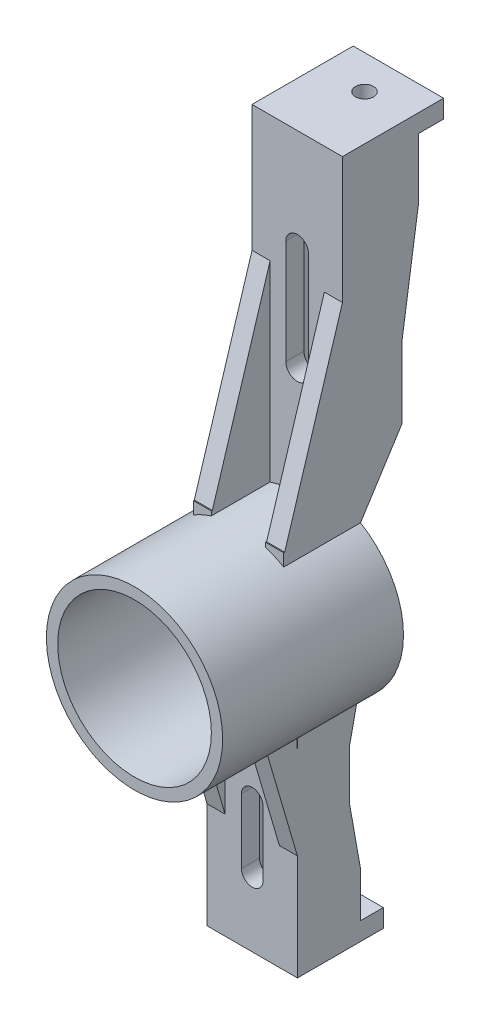
from build123d import *

# Parameters (mm, degrees)
SKETCH1_R            = 39
SKETCH1_R_2          = 34
BOSS_EXTRUDE1_DEPTH  = 80
BOSS_EXTRUDE2_DEPTH  = 20
BOSS_EXTRUDE3_DEPTH  = 20
BOSS_EXTRUDE4_DEPTH  = 8
BOSS_EXTRUDE5_DEPTH  = 8
CUT_EXTRUDE1_DEPTH   = 73
SKETCH13_R           = 4
CUT_EXTRUDE2_DEPTH   = 24
SKETCH14_R           = 4
CUT_EXTRUDE3_DEPTH   = 24
BOSS_EXTRUDE6_DEPTH  = 8
BOSS_EXTRUDE7_DEPTH  = 8
BOSS_EXTRUDE8_DEPTH  = 8
BOSS_EXTRUDE14_DEPTH = 8
BOSS_EXTRUDE15_DEPTH = 8
BOSS_EXTRUDE16_DEPTH = 8
BOSS_EXTRUDE17_DEPTH = 8
BOSS_EXTRUDE18_DEPTH = 26
BOSS_EXTRUDE19_REACH = 195.204


with BuildPart() as part:
    # Sketch1 → Boss-Extrude1 (new body)
    with BuildSketch(Plane.XY):
        Circle(SKETCH1_R)
        Circle(SKETCH1_R_2, mode=Mode.SUBTRACT)
    extrude(amount=BOSS_EXTRUDE1_DEPTH)



with BuildPart() as body_2:
    # Sketch3 → Boss-Extrude2 (new, symmetric)
    with BuildSketch(Plane(origin=(0, 0, 0), x_dir=(0, 0, -1), z_dir=(1, 0, 0))):
        Polygon((-8, 39), (-8, 177.8), (36.76, 177.8), (36.76, 169.8), (0, 169.8), (0, 39), align=None)
    extrude(amount=BOSS_EXTRUDE2_DEPTH, both=True)


with BuildPart() as body_3:
    # Sketch4 → Boss-Extrude3 (new, symmetric)
    with BuildSketch(Plane(origin=(0, 0, 0), x_dir=(0, 0, -1), z_dir=(1, 0, 0))):
        Polygon((-27.91, -39), (-27.91, -127), (10.09, -127), (10.09, -119), (-19.91, -119), (-19.91, -39), align=None)
    extrude(amount=BOSS_EXTRUDE3_DEPTH, both=True)


with BuildPart() as part_1:
    add(part.part)

    add(body_3.part)  # Boss-Extrude4 merges body 3
    # Sketch6 → Boss-Extrude4 (add)
    with BuildSketch(Plane(origin=(0, 0, 19.91), x_dir=(-1, 0, 0), z_dir=(0, 0, -1))):
        with BuildLine():
            ThreePointArc((20, -33.481338086), (10.373712322, -37.595027499), (0, -39))
            Line((0, -39), (20, -39))
            Line((20, -39), (20, -33.481338086))
        make_face()
        with BuildLine():
            Line((-20, -33.481338086), (-20, -39))
            Line((-20, -39), (0, -39))
            ThreePointArc((0, -39), (-10.373712322, -37.595027499), (-20, -33.481338086))
        make_face()
    extrude(amount=-BOSS_EXTRUDE4_DEPTH)


    add(body_2.part)  # Boss-Extrude5 merges body 2
    # Sketch7 → Boss-Extrude5 (add)
    with BuildSketch(Plane(origin=(0, 0, 0), x_dir=(-1, 0, 0), z_dir=(0, 0, -1))):
        with BuildLine():
            Line((0, 39), (-20, 39))
            Line((-20, 39), (-20, 33.481338086))
            ThreePointArc((-20, 33.481338086), (-10.373712322, 37.595027499), (0, 39))
        make_face()
        with BuildLine():
            Line((20, 39), (0, 39))
            ThreePointArc((0, 39), (10.373712322, 37.595027499), (20, 33.481338086))
            Line((20, 33.481338086), (20, 39))
        make_face()
    extrude(amount=-BOSS_EXTRUDE5_DEPTH)

    # Sketch12 → Cut-Extrude1 (cut)
    with BuildSketch(Plane(origin=(0, 0, 0), x_dir=(-1, 0, 0), z_dir=(0, 0, -1))):
        with BuildLine():
            Line((5.059933618, 132.933679622), (5.059933618, 86.710392146))
            ThreePointArc((5.059933618, 86.710392146), (0, 81.650458528), (-5.059933618, 86.710392146))
            Line((-5.059933618, 86.710392146), (-5.059933618, 132.933679622))
            ThreePointArc((-5.059933618, 132.933679622), (0, 137.993613239), (5.059933618, 132.933679622))
        make_face()
        with BuildLine():
            Line((4.756389645, -68.737317272), (4.756389645, -97.444530968))
            ThreePointArc((4.756389645, -97.444530968), (0, -102.200920613), (-4.756389645, -97.444530968))
            Line((-4.756389645, -97.444530968), (-4.756389645, -68.737317272))
            ThreePointArc((-4.756389645, -68.737317272), (0, -63.980927627), (4.756389645, -68.737317272))
        make_face()
    extrude(amount=-CUT_EXTRUDE1_DEPTH, mode=Mode.SUBTRACT)

    # Sketch13 → Cut-Extrude2 (cut)
    with BuildSketch(Plane(origin=(0, 177.8, 0), x_dir=(1, 0, 0), z_dir=(0, 1, 0))):
        with Locations(Location((0, 21.76, 0), (0, 0, 270))):
            Circle(SKETCH13_R)
    extrude(amount=-CUT_EXTRUDE2_DEPTH, mode=Mode.SUBTRACT)

    # Sketch14 → Cut-Extrude3 (cut)
    with BuildSketch(Plane.XZ.offset(127)):
        with Locations(Location((0, 4.91, 0), (0, 0, 270))):
            Circle(SKETCH14_R)
    extrude(amount=-CUT_EXTRUDE3_DEPTH, mode=Mode.SUBTRACT)

    # Sketch15 → Boss-Extrude6 (add)
    with BuildSketch(Plane(origin=(20, 0, 0), x_dir=(0, 0, -1), z_dir=(1, 0, 0))):
        Polygon((0, -119), (0, -99.086888853), (-4.91, -71.464610667), (-4.91, -49.814716953), (-1.4130197, -33.634678949), (-19.91, -33.481338086), (-19.91, -119), align=None)
    extrude(amount=-BOSS_EXTRUDE6_DEPTH)

    # Sketch16 → Boss-Extrude7 (add)
    with BuildSketch(Plane.ZY.offset(20)):
        Polygon((0, -119), (0, -99.086888853), (4.91, -71.464610667), (4.91, -49.814716953), (1.379878246, -33.481338086), (19.91, -33.481338086), (19.91, -119), align=None)
    extrude(amount=-BOSS_EXTRUDE7_DEPTH)

    # Sketch17 → Boss-Extrude8 (add)
    with BuildSketch(Plane(origin=(20, 0, 0), x_dir=(0, 0, -1), z_dir=(1, 0, 0))):
        Polygon((25.76, 169.8), (25.76, 143.643001818), (18.38, 94.201688411), (18.38, 62.304066859), (0, 33.481338086), (0, 169.8), align=None)
    extrude(amount=-BOSS_EXTRUDE8_DEPTH)

    # Sketch23 → Boss-Extrude14 (add)
    with BuildSketch(Plane(origin=(20, 0, 0), x_dir=(0, 0, -1), z_dir=(1, 0, 0))):
        Polygon((-8, 121.891336637), (-33.564768945, 39), (-8, 39), align=None)
        Polygon((-40, -39), (-27.91, -80.240669043), (-27.91, -39), align=None)
    extrude(amount=-BOSS_EXTRUDE14_DEPTH)

    # Sketch24 → Boss-Extrude15 (add)
    with BuildSketch(Plane.ZY.offset(20)):
        Polygon((0, 169.8), (-25.76, 169.8), (-25.76, 143.643001818), (-18.38, 94.201688411), (-18.38, 62.304066859), (0, 33.481338086), align=None)
    extrude(amount=-BOSS_EXTRUDE15_DEPTH)

    # Sketch25 → Boss-Extrude16 (add)
    with BuildSketch(Plane.ZY.offset(20)):
        Polygon((8, 39), (33.564768945, 39), (8, 121.891336637), align=None)
    extrude(amount=-BOSS_EXTRUDE16_DEPTH)

    # Sketch26 → Boss-Extrude17 (add)
    with BuildSketch(Plane.ZY.offset(20)):
        Polygon((27.91, -39), (27.91, -80.240669043), (40, -39), align=None)
    extrude(amount=-BOSS_EXTRUDE17_DEPTH)

    # Sketch28 → Boss-Extrude18 (add)
    with BuildSketch(Plane.XY.offset(8)):
        with BuildLine():
            ThreePointArc((-12, 37.107950631), (-16.102424651, 35.52058446), (-20, 33.481338086))
            Line((-20, 33.481338086), (-20, 39))
            Line((-20, 39), (-12, 39))
            Line((-12, 39), (-12, 37.107950631))
        make_face()
        with BuildLine():
            ThreePointArc((20, 33.481338086), (16.102424651, 35.52058446), (12, 37.107950631))
            Line((12, 37.107950631), (12, 39))
            Line((12, 39), (20, 39))
            Line((20, 39), (20, 33.481338086))
        make_face()
    extrude(amount=BOSS_EXTRUDE18_DEPTH)

    # Boss-Extrude19: up to this plane
    boss_extrude19_end = Plane(origin=(-12, -80.240669043, 27.91), z_dir=(0, -0.2813179552300577, 0.9596146143453523))
    # Sketch29 → Boss-Extrude19 (add, up to the surface)
    with BuildSketch(Plane.XY.offset(28), mode=Mode.PRIVATE) as boss_extrude19_sk1:
        with BuildLine():
            Line((-12, -39), (-12, -37.107950631))
            ThreePointArc((-12, -37.107950631), (-16.102424651, -35.52058446), (-20, -33.481338086))
            Line((-20, -33.481338086), (-20, -39))
            Line((-20, -39), (-12, -39))
        make_face()
    boss_extrude19_tool1 = split(extrude(boss_extrude19_sk1.sketch, amount=BOSS_EXTRUDE19_REACH, mode=Mode.PRIVATE), bisect_by=boss_extrude19_end, keep=Keep.BOTH, mode=Mode.PRIVATE)
    add(boss_extrude19_tool1.solids().sort_by_distance((-16.684032, -37.08267, 28))[0])
    # Sketch29 → Boss-Extrude19 (add, up to the surface)
    with BuildSketch(Plane.XY.offset(28), mode=Mode.PRIVATE) as boss_extrude19_sk2:
        with BuildLine():
            Line((12, -39), (12, -37.107950631))
            ThreePointArc((12, -37.107950631), (16.102424651, -35.52058446), (20, -33.481338086))
            Line((20, -33.481338086), (20, -39))
            Line((20, -39), (12, -39))
        make_face()
    boss_extrude19_tool2 = split(extrude(boss_extrude19_sk2.sketch, amount=BOSS_EXTRUDE19_REACH, mode=Mode.PRIVATE), bisect_by=boss_extrude19_end, keep=Keep.BOTH, mode=Mode.PRIVATE)
    add(boss_extrude19_tool2.solids().sort_by_distance((16.684032, -37.08267, 28))[0])


solid = part_1.part
